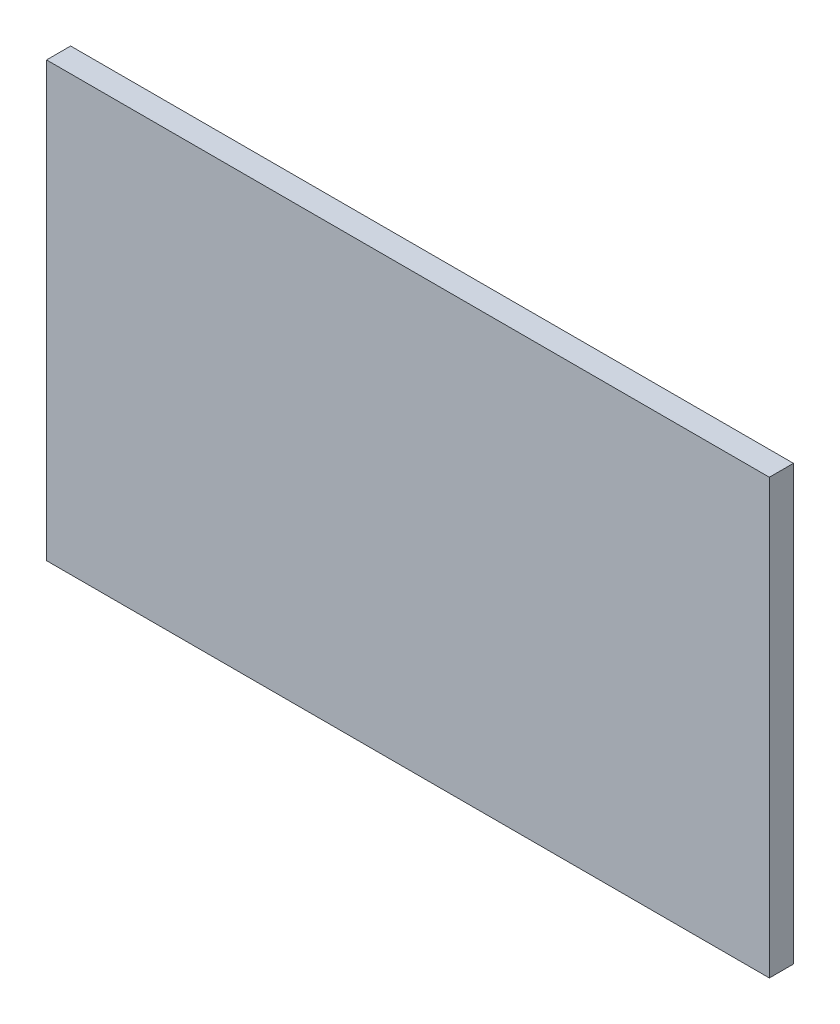
from build123d import *

# Parameters (mm, degrees)
SKETCH1_W           = 300
SKETCH1_H           = 180
BOSS_EXTRUDE1_DEPTH = 10


with BuildPart() as part:
    # Sketch1 → Boss-Extrude1 (new body)
    with BuildSketch(Plane.XY):
        with Locations((150, 90)):
            Rectangle(SKETCH1_W, SKETCH1_H)
    extrude(amount=BOSS_EXTRUDE1_DEPTH)


solid = part.part
